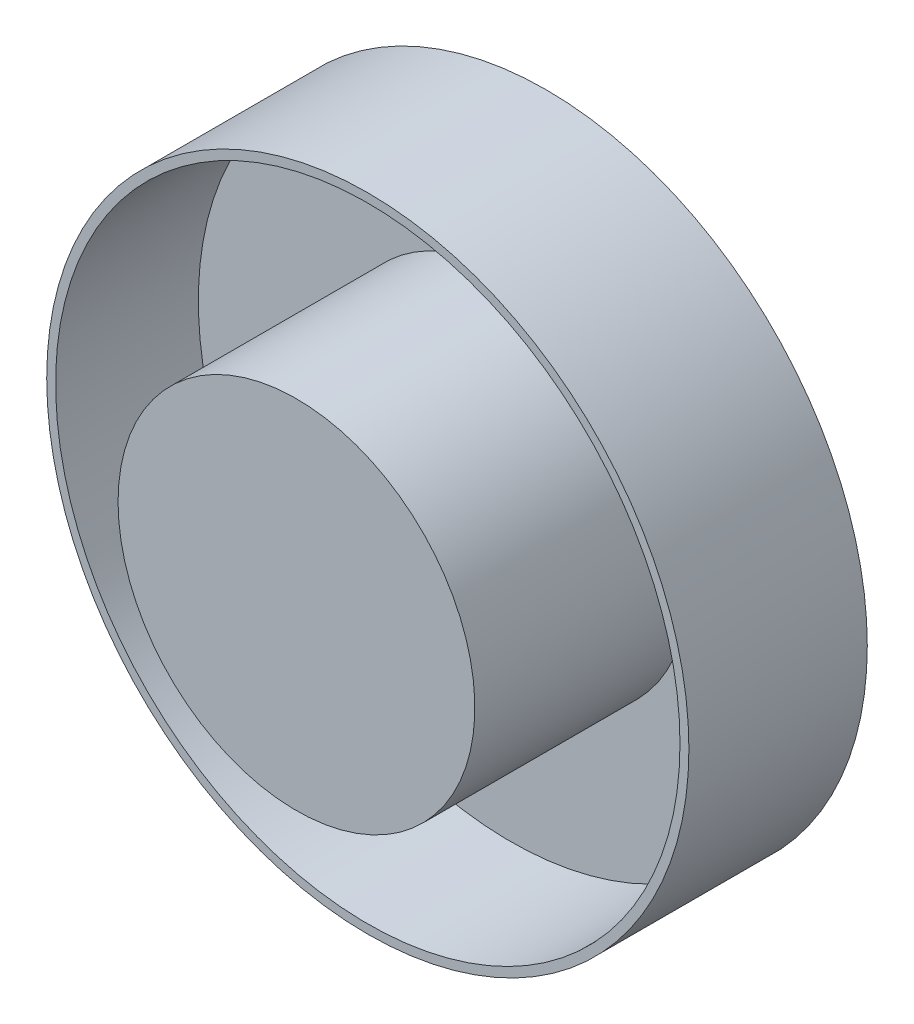
from build123d import *

# Parameters (mm, degrees)
SKETCH1_R           = 22.86
BOSS_EXTRUDE1_DEPTH = 12.7
SKETCH2_R           = 22.225
CUT_EXTRUDE1_DEPTH  = 10.16
SKETCH3_R           = 12.7
BOSS_EXTRUDE2_DEPTH = 15.24


with BuildPart() as part:
    # Sketch1 → Boss-Extrude1 (new body)
    with BuildSketch(Plane.XY):
        Circle(SKETCH1_R)
    extrude(amount=BOSS_EXTRUDE1_DEPTH)

    # Sketch2 → Cut-Extrude1 (cut)
    with BuildSketch(Plane.XY.offset(12.7)):
        Circle(SKETCH2_R)
    extrude(amount=-CUT_EXTRUDE1_DEPTH, mode=Mode.SUBTRACT)

    # Sketch3 → Boss-Extrude2 (add)
    with BuildSketch(Plane.XY.offset(2.54)):
        with Locations(Location((0, 0, 0), (0, 0, 180))):
            Circle(SKETCH3_R)
    extrude(amount=BOSS_EXTRUDE2_DEPTH)


solid = part.part
